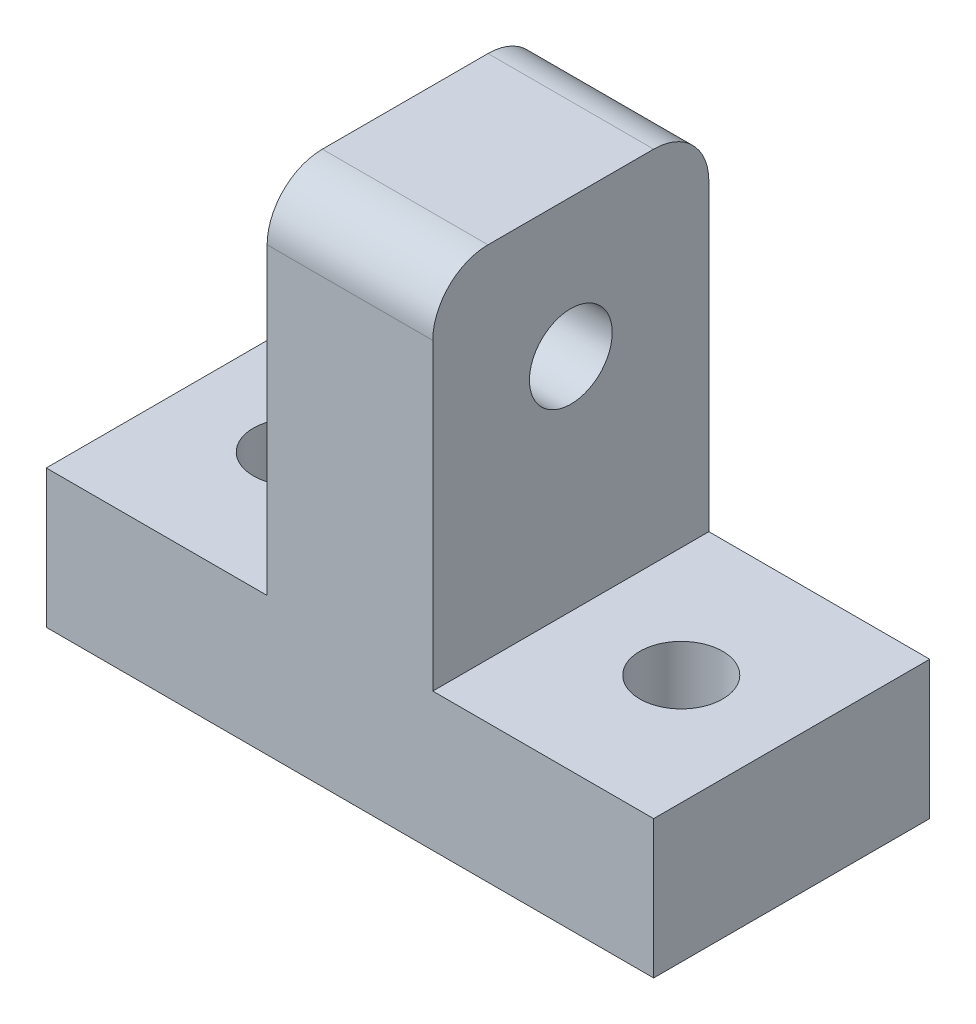
from build123d import *

# Parameters (mm, degrees)
SKETCH1_W           = 22
SKETCH1_H           = 10
SKETCH1_R           = 1.5
BOSS_EXTRUDE1_DEPTH = 5
SKETCH4_W           = 6
SKETCH4_H           = 10
BOSS_EXTRUDE3_DEPTH = 13
CUT_EXTRUDE1_REACH  = 25.345
SKETCH5_R           = 1.5
FILLET1_R           = 2


with BuildPart() as part:
    # Sketch1 → Boss-Extrude1 (new body)
    with BuildSketch(Plane(origin=(0, 0, 0), x_dir=(1, 0, 0), z_dir=(0, 1, 0))):
        Rectangle(SKETCH1_W, SKETCH1_H)
        with Locations(Location((-7, 0, 0), (0, 0, 270))):
            Circle(SKETCH1_R, mode=Mode.SUBTRACT)
        with Locations(Location((7, 0, 0), (0, 0, 270))):
            Circle(SKETCH1_R, mode=Mode.SUBTRACT)
    extrude(amount=BOSS_EXTRUDE1_DEPTH)

    # Sketch4 → Boss-Extrude3 (add)
    with BuildSketch(Plane(origin=(0, 5, 0), x_dir=(1, 0, 0), z_dir=(0, 1, 0))):
        Rectangle(SKETCH4_W, SKETCH4_H)
    extrude(amount=BOSS_EXTRUDE3_DEPTH)

    # Sketch5 → Cut-Extrude1 (cut, up to next)
    with BuildSketch(Plane(origin=(3, 0, 0), x_dir=(0, 0, -1), z_dir=(1, 0, 0)), mode=Mode.PRIVATE) as cut_extrude1_sk1:
        with Locations((0, 13)):
            Circle(SKETCH5_R)
    cut_extrude1_tool1 = extrude(cut_extrude1_sk1.sketch, amount=-CUT_EXTRUDE1_REACH, mode=Mode.PRIVATE) & part.part
    add(cut_extrude1_tool1.solids().sort_by_distance((3, 13, 0))[0], mode=Mode.SUBTRACT)

    # Fillet1
    fillet1_edges = [part.edges().sort_by_distance(p)[0] for p in [
        (0, 18, -5),
        (0, 18, 5),
    ]]
    fillet(fillet1_edges, radius=FILLET1_R)


solid = part.part
